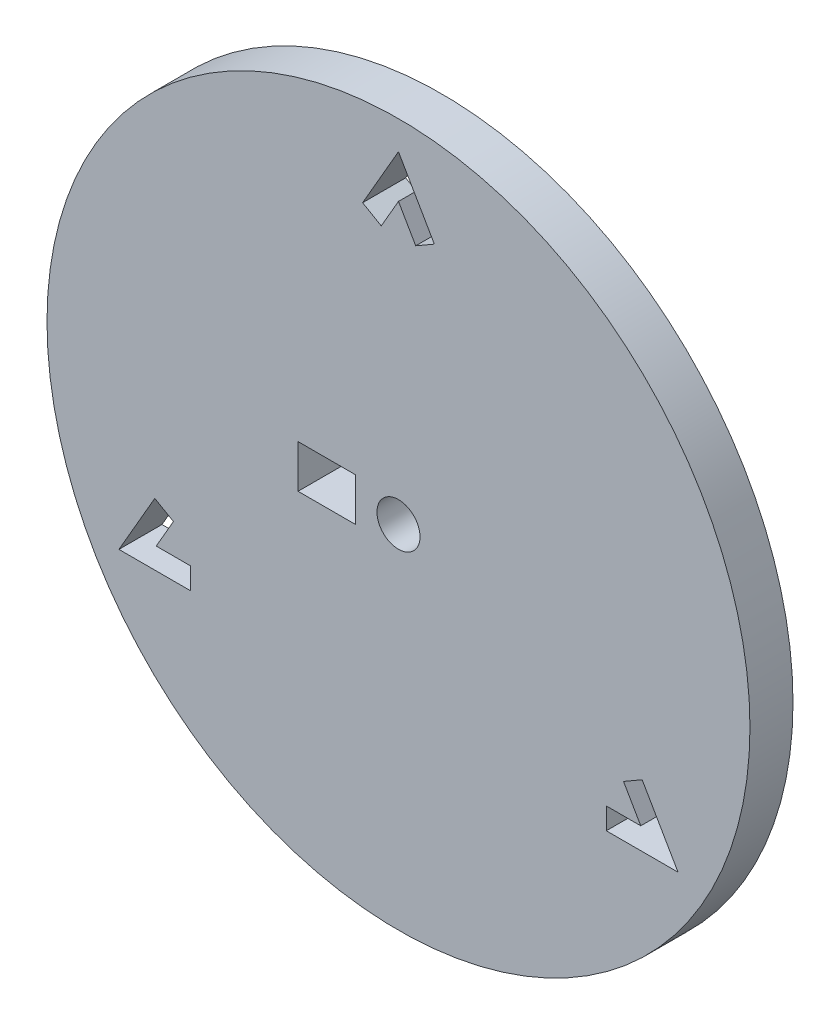
from build123d import *

# Parameters (mm, degrees)
CROQUIS1_R              = 49
SALIENTE_EXTRUIR1_DEPTH = 6
CROQUIS2_R              = 3
CORTAR_EXTRUIR1_DEPTH   = 10


with BuildPart() as part:
    # Croquis1 → Saliente-Extruir1 (new body)
    # profile 1 of 2: a face of its own
    with BuildSketch(Plane.XY):
        Circle(CROQUIS1_R)
        Polygon((-5, 36.339745962), (0, 45), (5, 36.339745962), (33.97114317, -13.839745962), (38.97114317, -22.5), (28.97114317, -22.5), (-28.97114317, -22.5), (-38.97114317, -22.5), (-33.97114317, -13.839745962), align=None, mode=Mode.SUBTRACT)
    # profile 2 of 2: a face of its own
    with BuildSketch(Plane.XY):
        Polygon((-2.401923789, 34.839745962), (-5, 36.339745962), (-33.97114317, -13.839745962), (-31.373066959, -15.339745962), (-33.774990748, -19.5), (-28.97114317, -19.5), (-28.97114317, -22.5), (28.97114317, -22.5), (28.97114317, -19.5), (33.774990748, -19.5), (31.373066959, -15.339745962), (33.97114317, -13.839745962), (5, 36.339745962), (2.401923789, 34.839745962), (0, 39), align=None)
    extrude(amount=SALIENTE_EXTRUIR1_DEPTH)

    # Croquis2 → Cortar-Extruir1 (cut)
    with BuildSketch(Plane.XY.offset(6)):
        with BuildLine():
            Line((-9.539392014, 3), (-14, 3))
            Line((-14, 3), (-14, -3))
            Line((-14, -3), (-9.539392014, -3))
            ThreePointArc((-9.539392014, -3), (-10, 0), (-9.539392014, 3))
        make_face()
        with BuildLine():
            Line((-6, 3), (-9.539392014, 3))
            ThreePointArc((-9.539392014, 3), (-10, 0), (-9.539392014, -3))
            Line((-9.539392014, -3), (-6, -3))
            Line((-6, -3), (-6, 3))
        make_face()
        Circle(CROQUIS2_R)
    extrude(amount=-CORTAR_EXTRUIR1_DEPTH, mode=Mode.SUBTRACT)


solid = part.part
